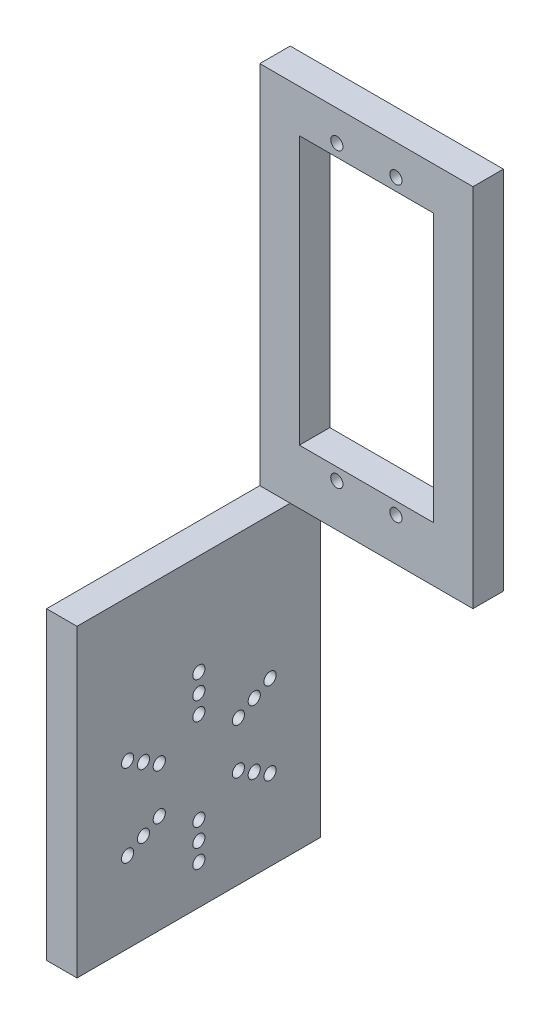
from build123d import *

# Parameters (mm, degrees)
SKETCH1_W           = 35
SKETCH1_H           = 60
SKETCH1_R           = 1
SKETCH1_W_2         = 22
SKETCH1_H_2         = 44
BOSS_EXTRUDE1_DEPTH = 5
SKETCH2_W           = 5
SKETCH2_H           = 50
BOSS_EXTRUDE2_DEPTH = 40
SKETCH3_R           = 1
CUT_EXTRUDE1_DEPTH  = 5


with BuildPart() as part:
    # Sketch1 → Boss-Extrude1 (new body)
    with BuildSketch(Plane.XY):
        with Locations((0, -1)):
            Rectangle(SKETCH1_W, SKETCH1_H)
        with Locations((-4.85, -24)):
            Circle(SKETCH1_R, mode=Mode.SUBTRACT)
        with Locations((4.85, -24)):
            Circle(SKETCH1_R, mode=Mode.SUBTRACT)
        with Locations((4.85, 24)):
            Circle(SKETCH1_R, mode=Mode.SUBTRACT)
        with Locations((-4.85, 24)):
            Circle(SKETCH1_R, mode=Mode.SUBTRACT)
        Rectangle(SKETCH1_W_2, SKETCH1_H_2, mode=Mode.SUBTRACT)
    extrude(amount=BOSS_EXTRUDE1_DEPTH)

    # Sketch2 → Boss-Extrude2 (add)
    with BuildSketch(Plane.XY):
        with Locations((-15, -56)):
            Rectangle(SKETCH2_W, SKETCH2_H)
    extrude(amount=BOSS_EXTRUDE2_DEPTH)

    # Sketch3 → Cut-Extrude1 (cut)
    with BuildSketch(Plane(origin=(-12.5, 0, 0), x_dir=(0, 0, -1), z_dir=(1, 0, 0))):
        with Locations(Location((-20, -74.5, 0), (0, 0, 90))):
            Circle(SKETCH3_R)
        with Locations(Location((-20, -71.5, 0), (0, 0, 90))):
            Circle(SKETCH3_R)
        with Locations(Location((-20, -68.5, 0), (0, 0, 90))):
            Circle(SKETCH3_R)
        with Locations(Location((-26.495190528, -64.75, 0), (0, 0, 90))):
            Circle(SKETCH3_R)
        with Locations(Location((-29.09326674, -66.25, 0), (0, 0, 90))):
            Circle(SKETCH3_R)
        with Locations(Location((-31.691342951, -67.75, 0), (0, 0, 90))):
            Circle(SKETCH3_R)
        with Locations(Location((-26.495190528, -57.25, 0), (0, 0, 90))):
            Circle(SKETCH3_R)
        with Locations(Location((-29.09326674, -55.75, 0), (0, 0, 90))):
            Circle(SKETCH3_R)
        with Locations(Location((-31.691342951, -54.25, 0), (0, 0, 90))):
            Circle(SKETCH3_R)
        with Locations(Location((-20, -53.5, 0), (0, 0, 90))):
            Circle(SKETCH3_R)
        with Locations(Location((-20, -50.5, 0), (0, 0, 90))):
            Circle(SKETCH3_R)
        with Locations(Location((-20, -47.5, 0), (0, 0, 90))):
            Circle(SKETCH3_R)
        with Locations(Location((-13.504809472, -57.25, 0), (0, 0, 90))):
            Circle(SKETCH3_R)
        with Locations(Location((-10.90673326, -55.75, 0), (0, 0, 90))):
            Circle(SKETCH3_R)
        with Locations(Location((-8.308657049, -54.25, 0), (0, 0, 90))):
            Circle(SKETCH3_R)
        with Locations(Location((-13.504809472, -64.75, 0), (0, 0, 90))):
            Circle(SKETCH3_R)
        with Locations(Location((-10.90673326, -66.25, 0), (0, 0, 90))):
            Circle(SKETCH3_R)
        with Locations(Location((-8.308657049, -67.75, 0), (0, 0, 90))):
            Circle(SKETCH3_R)
    extrude(amount=-CUT_EXTRUDE1_DEPTH, mode=Mode.SUBTRACT)


solid = part.part
